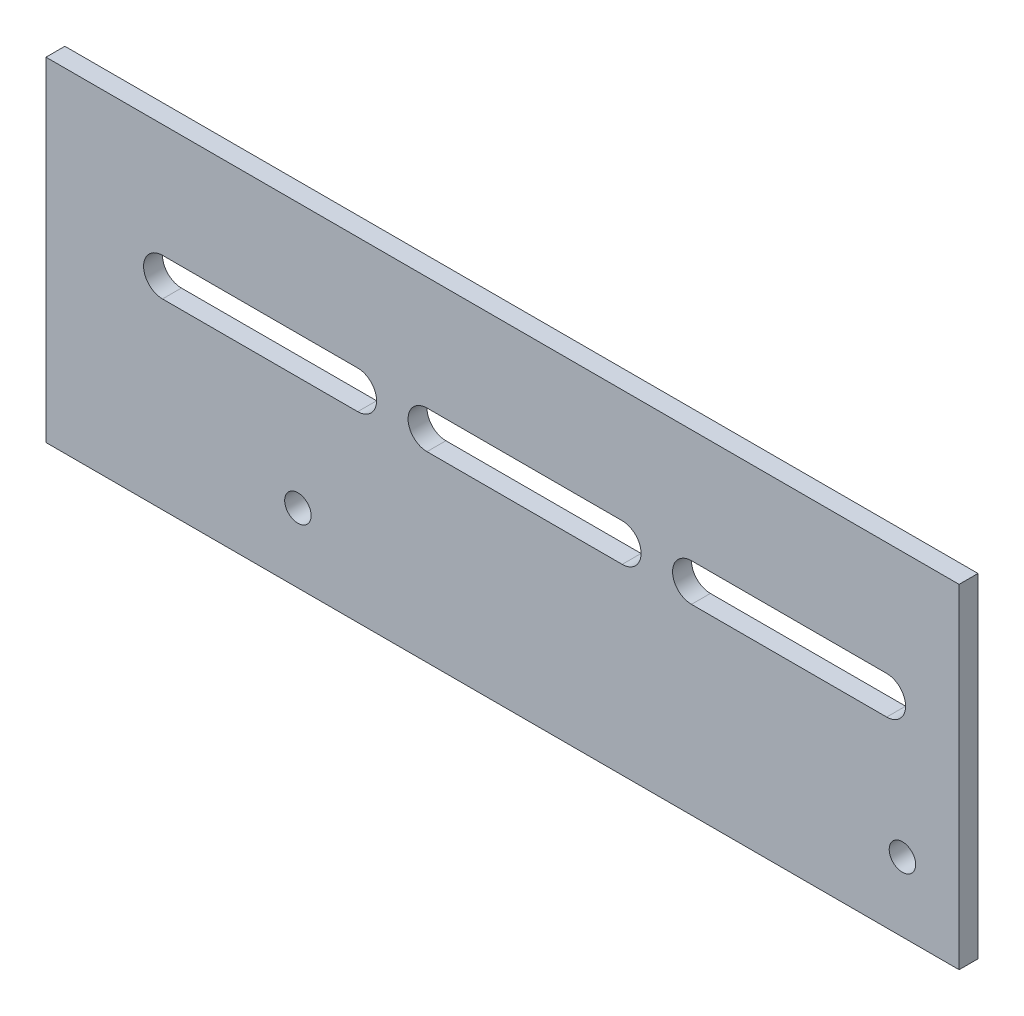
from build123d import *

# Parameters (mm, degrees)
LID_RISER_WITH_VENTS_PROFILE_W = 145
LID_RISER_WITH_VENTS_PROFILE_H = 53
LID_RISER_WITH_VENTS_PROFILE_R = 2.1
LID_RISER_WITH_VENTS_DEPTH     = 3


with BuildPart() as part:
    # Lid riser with vents profile → Lid riser with vents (new body)
    with BuildSketch(Plane.XY):
        with Locations((-18.5, 76.5)):
            Rectangle(LID_RISER_WITH_VENTS_PROFILE_W, LID_RISER_WITH_VENTS_PROFILE_H)
        with Locations((-51, 61)):
            Circle(LID_RISER_WITH_VENTS_PROFILE_R, mode=Mode.SUBTRACT)
        with Locations((45, 61)):
            Circle(LID_RISER_WITH_VENTS_PROFILE_R, mode=Mode.SUBTRACT)
        with BuildLine():
            Line((-72.5, 79), (-41.5, 79))
            ThreePointArc((-41.5, 79), (-38.5, 82), (-41.5, 85))
            Line((-41.5, 85), (-72.5, 85))
            ThreePointArc((-72.5, 85), (-75.5, 82), (-72.5, 79))
        make_face(mode=Mode.SUBTRACT)
        with BuildLine():
            Line((-30.5, 79), (0.5, 79))
            ThreePointArc((0.5, 79), (3.5, 82), (0.5, 85))
            Line((0.5, 85), (-30.5, 85))
            ThreePointArc((-30.5, 85), (-33.5, 82), (-30.5, 79))
        make_face(mode=Mode.SUBTRACT)
        with BuildLine():
            Line((11.5, 79), (42.5, 79))
            ThreePointArc((42.5, 79), (45.5, 82), (42.5, 85))
            Line((42.5, 85), (11.5, 85))
            ThreePointArc((11.5, 85), (8.5, 82), (11.5, 79))
        make_face(mode=Mode.SUBTRACT)
    extrude(amount=LID_RISER_WITH_VENTS_DEPTH)


solid = part.part
